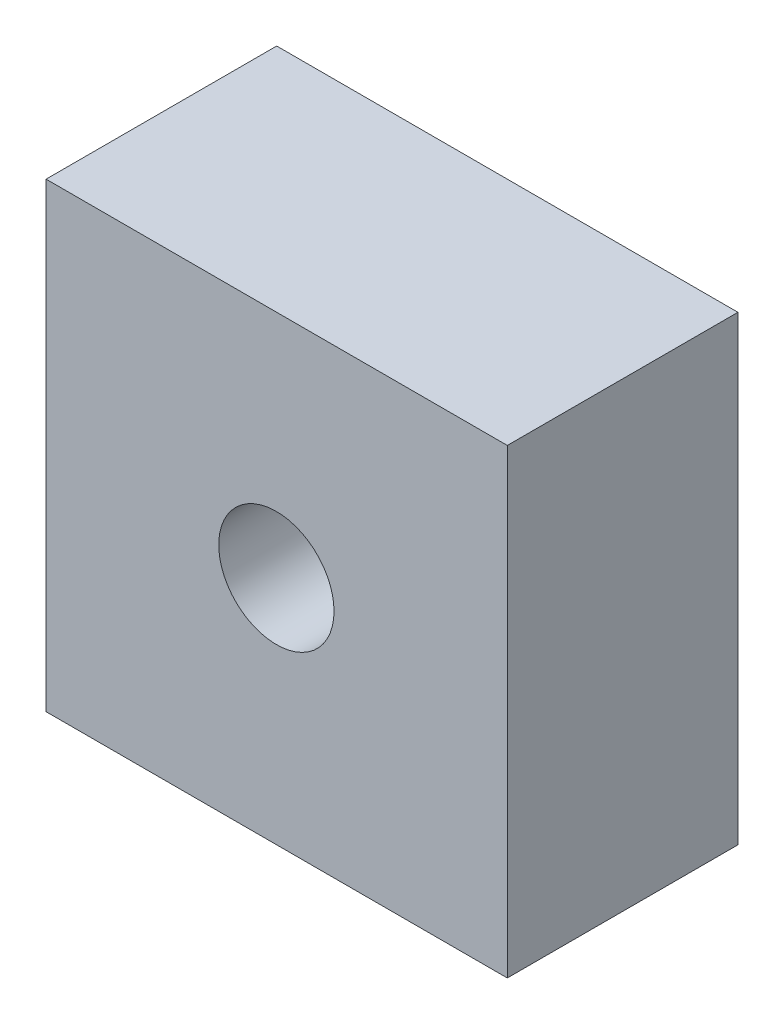
from build123d import *

# Parameters (mm, degrees)
SKETCH_1_W         = 20
SKETCH_1_H         = 20
BASEBOX_DEPTH      = 10
HOLE_WIZARD_M6_1_D = 5


with BuildPart() as part:
    # 草图1 → BaseBox (new body)
    with BuildSketch(Plane.XY):
        with Locations((10, 10)):
            Rectangle(SKETCH_1_W, SKETCH_1_H)
    extrude(amount=BASEBOX_DEPTH)

    # M6 螺纹孔1 (through all)
    with Locations(Plane.XY.offset(10)):
        with Locations((9.986487375, 10.014305599)):
            Hole(HOLE_WIZARD_M6_1_D / 2)


solid = part.part
